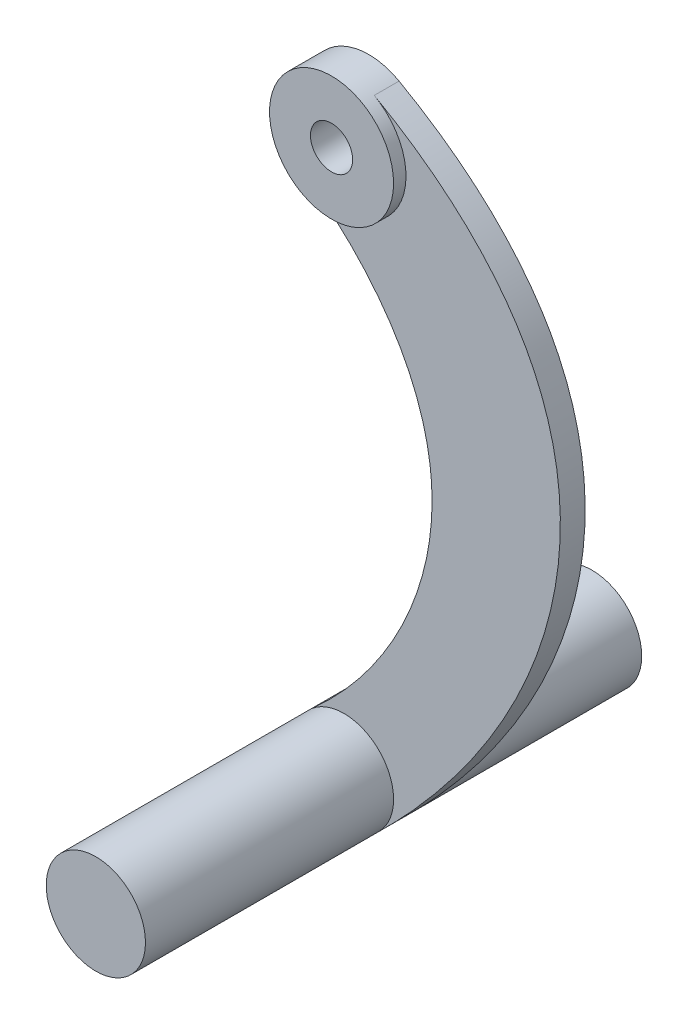
from build123d import *

# Parameters (mm, degrees)
SKETCH1_R                = 12.5
SKETCH1_R_2              = 4.25
BOSS_EXTRUDE1_DEPTH      = 2.5
BOSS_EXTRUDE2_START      = 5
BOSS_EXTRUDE2_DEPTH      = 5
BOSS_EXTRUDE3_DEPTH      = 50
BOSS_EXTRUDE3_DEPTH_BACK = 50
SKETCH3_R                = 10
CUT_EXTRUDE1_START       = -40
SKETCH4_R                = 4.25
CUT_EXTRUDE1_DEPTH       = 40


with BuildPart() as part:
    # Sketch1 → Boss-Extrude1 (new body)
    with BuildSketch(Plane.XY):
        Circle(SKETCH1_R)
        Circle(SKETCH1_R_2, mode=Mode.SUBTRACT)
    extrude(amount=BOSS_EXTRUDE1_DEPTH)

    # Sketch2 → Boss-Extrude2 (add)
    with BuildSketch(Plane(origin=(0, 0, 0), x_dir=(-1, 0, 0), z_dir=(0, 0, -1)).offset(BOSS_EXTRUDE2_START)):
        with BuildLine():
            ThreePointArc((-6.106396375, 10.906966733), (10.50822507, 6.769579446), (7.406819033, -10.069212075))
            add(Edge.make_bspline(
                [(7.406819033, -10.069212075), (-7.979907505, -21.387545439), (-26.855730435, -52.646283336), (-9.439793984, -88.354039493), (6.611094261, -102.497105047)],
                knots=[0, 0, 0, 0, 0.455821989, 1, 1, 1, 1], degree=3))
            ThreePointArc((6.611094261, -102.497105047), (7.323414251, -116.809376161), (-7.00278738, -117.138695182))
            add(Edge.make_bspline(
                [(-6.106396375, 10.906966733), (-20.621715475, 2.78039093), (-57.030134585, -32.014511607), (-40.003016754, -84.766730291), (-7.00278738, -117.138695182)],
                knots=[0, 0, 0, 0, 0.30202419, 1, 1, 1, 1], degree=3))
        make_face()
    extrude(amount=-BOSS_EXTRUDE2_DEPTH)

    # Sketch3 → Boss-Extrude3 (add, two sides: drawn at the far end of the back side and taken through both)
    with BuildSketch(Plane.XY.offset(-BOSS_EXTRUDE3_DEPTH_BACK)):
        with Locations((0, -110)):
            Circle(SKETCH3_R)
    extrude(amount=BOSS_EXTRUDE3_DEPTH + BOSS_EXTRUDE3_DEPTH_BACK)

    # Sketch4 → Cut-Extrude1 (cut)
    with BuildSketch(Plane.XY.offset(CUT_EXTRUDE1_START)):
        Circle(SKETCH4_R)
    extrude(amount=CUT_EXTRUDE1_DEPTH, mode=Mode.SUBTRACT)


solid = part.part
